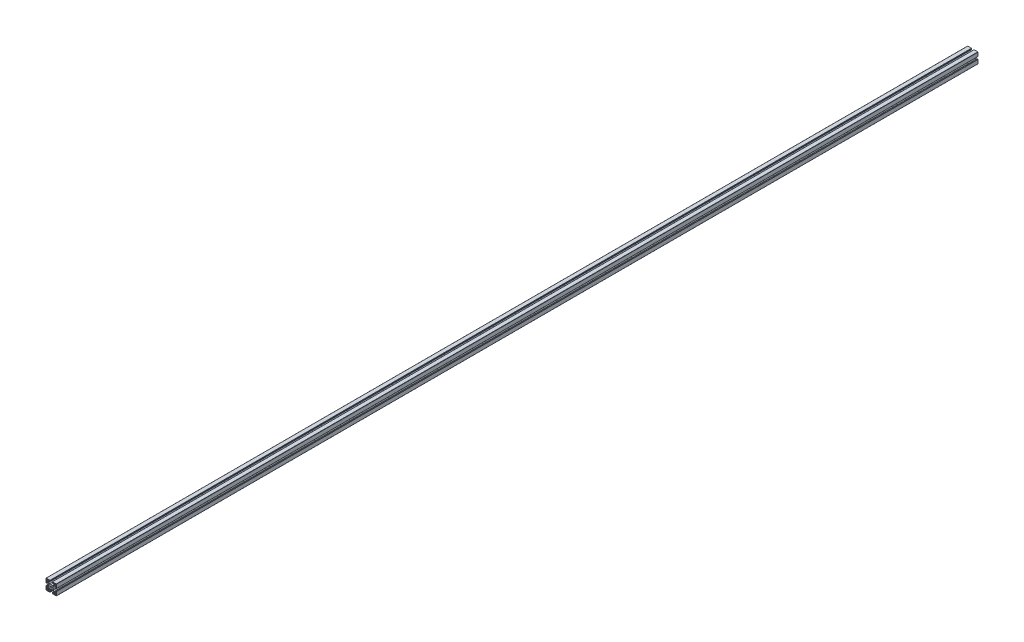
from build123d import *

# Parameters (mm, degrees)
SKETCH1_W           = 6.6
SKETCH1_H           = 6.6
SKETCH1_R           = 3.45
BOSS_EXTRUDE3_DEPTH = 3500
FILLET1_R           = 0.8


with BuildPart() as part:
    # Sketch1 → Boss-Extrude3 (new body)
    # profile 1 of 9: a face of its own
    with BuildSketch(Plane.XY):
        Polygon((19.8, 19.8), (4.2, 19.8), (4.2, 15.3), (6.9, 15.3), (6.9, 17.1), (10.1, 17.1), (10.1, 12.009188309), (5.790811691, 7.7), (7.7, 7.7), (7.7, 5.790811691), (12.009188309, 10.1), (17.1, 10.1), (17.1, 6.9), (15.3, 6.9), (15.3, 4.2), (19.8, 4.2), align=None)
        with Locations((15, 15)):
            Rectangle(SKETCH1_W, SKETCH1_H, mode=Mode.SUBTRACT)
    # profile 2 of 9: a face of its own
    with BuildSketch(Plane.XY):
        Polygon((4.2, -15.3), (4.2, -19.8), (19.8, -19.8), (19.8, -4.2), (15.3, -4.2), (15.3, -6.9), (17.1, -6.9), (17.1, -10.1), (12.009188309, -10.1), (7.7, -5.790811691), (7.7, -7.7), (5.790811691, -7.7), (10.1, -12.009188309), (10.1, -17.1), (6.9, -17.1), (6.9, -15.3), align=None)
        with Locations((15, -15)):
            Rectangle(SKETCH1_W, SKETCH1_H, mode=Mode.SUBTRACT)
    # profile 3 of 9: a face of its own
    with BuildSketch(Plane.XY):
        Polygon((-15.3, -4.2), (-19.8, -4.2), (-19.8, -19.8), (-4.2, -19.8), (-4.2, -15.3), (-6.9, -15.3), (-6.9, -17.1), (-10.1, -17.1), (-10.1, -12.009188309), (-5.790811691, -7.7), (-7.7, -7.7), (-7.7, -5.790811691), (-12.009188309, -10.1), (-17.1, -10.1), (-17.1, -6.9), (-15.3, -6.9), align=None)
        with Locations((-15, -15)):
            Rectangle(SKETCH1_W, SKETCH1_H, mode=Mode.SUBTRACT)
    # profile 4 of 9: a face of its own
    with BuildSketch(Plane.XY):
        Polygon((-19.8, 19.8), (-19.8, 4.2), (-15.3, 4.2), (-15.3, 6.9), (-17.1, 6.9), (-17.1, 10.1), (-12.009188309, 10.1), (-7.7, 5.790811691), (-7.7, 7.7), (-5.790811691, 7.7), (-10.1, 12.009188309), (-10.1, 17.1), (-6.9, 17.1), (-6.9, 15.3), (-4.2, 15.3), (-4.2, 19.8), align=None)
        with Locations((-15, 15)):
            Rectangle(SKETCH1_W, SKETCH1_H, mode=Mode.SUBTRACT)
    # profile 5 of 9: a face of its own
    with BuildSketch(Plane.XY):
        Polygon((7.7, -5.790811691), (7.7, 5.790811691), (5.27, 3.360811691), (5.27, 0), (5.27, -3.360811691), align=None)
    # profile 6 of 9: a face of its own
    with BuildSketch(Plane.XY):
        Polygon((-7.7, 7.7), (-7.7, 5.790811691), (-5.27, 3.360811691), (-5.27, 0), (-5.27, -3.360811691), (-7.7, -5.790811691), (-7.7, -7.7), (-5.790811691, -7.7), (-3.360811691, -5.27), (0, -5.27), (3.360811691, -5.27), (5.790811691, -7.7), (7.7, -7.7), (7.7, -5.790811691), (5.27, -3.360811691), (5.27, 0), (5.27, 3.360811691), (7.7, 5.790811691), (7.7, 7.7), (5.790811691, 7.7), (3.360811691, 5.27), (0, 5.27), (-3.360811691, 5.27), (-5.790811691, 7.7), align=None)
        Circle(SKETCH1_R, mode=Mode.SUBTRACT)
    # profile 7 of 9: a face of its own
    with BuildSketch(Plane.XY):
        Polygon((5.790811691, 7.7), (-5.790811691, 7.7), (-3.360811691, 5.27), (0, 5.27), (3.360811691, 5.27), align=None)
    # profile 8 of 9: a face of its own
    with BuildSketch(Plane.XY):
        Polygon((-5.27, 3.360811691), (-7.7, 5.790811691), (-7.7, -5.790811691), (-5.27, -3.360811691), (-5.27, 0), align=None)
    # profile 9 of 9: a face of its own
    with BuildSketch(Plane.XY):
        Polygon((-3.360811691, -5.27), (-5.790811691, -7.7), (5.790811691, -7.7), (3.360811691, -5.27), (0, -5.27), align=None)
    extrude(amount=BOSS_EXTRUDE3_DEPTH)

    # Fillet1
    fillet1_edges = [part.edges().sort_by_distance(p)[0] for p in [
        (-11.7, -11.7, 1750),
        (-18.3, -11.7, 1750),
        (-18.3, -18.3, 1750),
        (-11.7, -18.3, 1750),
        (11.7, -11.7, 1750),
        (11.7, -18.3, 1750),
        (18.3, -18.3, 1750),
        (18.3, -11.7, 1750),
        (-18.3, 18.3, 1750),
        (-18.3, 11.7, 1750),
        (-11.7, 11.7, 1750),
        (-11.7, 18.3, 1750),
        (11.7, 11.7, 1750),
        (18.3, 11.7, 1750),
        (18.3, 18.3, 1750),
        (11.7, 18.3, 1750),
        (-7.7, 5.790811691, 1750),
        (-12.009188309, 10.1, 1750),
        (-17.1, 10.1, 1750),
        (-17.1, 6.9, 1750),
        (-15.3, 6.9, 1750),
        (-15.3, 4.2, 1750),
        (-19.8, 4.2, 1750),
        (-19.8, 19.8, 1750),
        (-4.2, 19.8, 1750),
        (-4.2, 15.3, 1750),
        (-6.9, 15.3, 1750),
        (-6.9, 17.1, 1750),
        (-10.1, 17.1, 1750),
        (-10.1, 12.009188309, 1750),
        (5.790811691, 7.7, 1750),
        (10.1, 12.009188309, 1750),
        (10.1, 17.1, 1750),
        (6.9, 17.1, 1750),
        (4.2, 15.3, 1750),
        (4.2, 19.8, 1750),
        (19.8, 19.8, 1750),
        (19.8, 4.2, 1750),
        (15.3, 4.2, 1750),
        (15.3, 6.9, 1750),
        (17.1, 6.9, 1750),
        (17.1, 10.1, 1750),
        (12.009188309, 10.1, 1750),
        (7.7, 5.790811691, 1750),
        (7.7, -5.790811691, 1750),
        (12.009188309, -10.1, 1750),
        (17.1, -10.1, 1750),
        (17.1, -6.9, 1750),
        (15.3, -6.9, 1750),
        (15.3, -4.2, 1750),
        (19.8, -4.2, 1750),
        (19.8, -19.8, 1750),
        (4.2, -19.8, 1750),
        (4.2, -15.3, 1750),
        (6.9, -17.1, 1750),
        (10.1, -17.1, 1750),
        (10.1, -12.009188309, 1750),
        (5.790811691, -7.7, 1750),
        (-5.790811691, -7.7, 1750),
        (-10.1, -12.009188309, 1750),
        (-10.1, -17.1, 1750),
        (-6.9, -17.1, 1750),
        (-6.9, -15.3, 1750),
        (-4.2, -15.3, 1750),
        (-4.2, -19.8, 1750),
        (-19.8, -19.8, 1750),
        (-19.8, -4.2, 1750),
        (-15.3, -4.2, 1750),
        (-15.3, -6.9, 1750),
        (-17.1, -10.1, 1750),
        (-12.009188309, -10.1, 1750),
        (-7.7, -5.790811691, 1750),
    ]]
    fillet(fillet1_edges, radius=FILLET1_R)


solid = part.part
